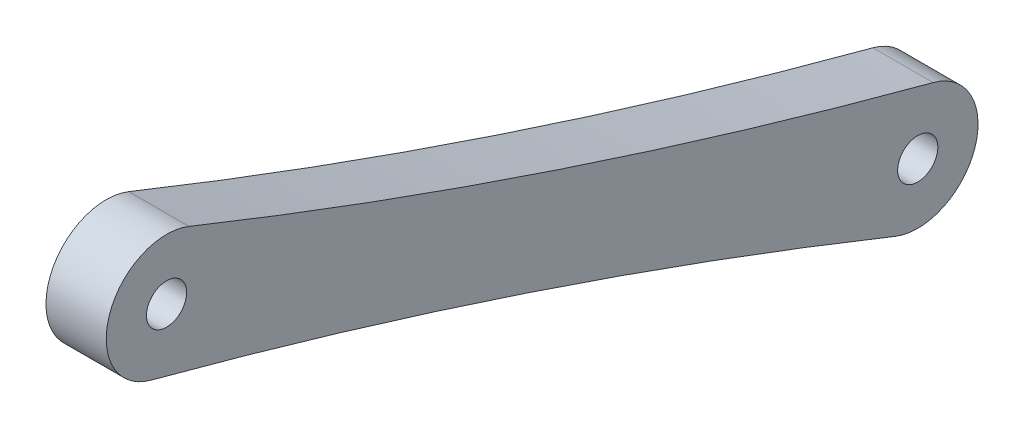
from build123d import *

# Parameters (mm, degrees)
SKETCH2_R               = 1
BOSS_EXTRUDE2_DEPTH     = 3
SCALE1_SCALE            = 2
CUT_EXTRUDE1_DEPTH      = 166.58723061
CUT_EXTRUDE1_DEPTH_BACK = 166.58723061


with BuildPart() as part:
    # Sketch2 → Boss-Extrude2 (new body)
    with BuildSketch(Plane.YZ):
        with BuildLine():
            ThreePointArc((19.533132157, 81.629722684), (24.352585485, 66.108442404), (37.508583242, 75.650821296))
            ThreePointArc((37.508583242, 75.650821296), (40.136593734, 92.158254486), (47.919515666, 106.951087747))
            ThreePointArc((47.919515666, 106.951087747), (43.100062338, 122.472368027), (29.944064581, 112.929989135))
            ThreePointArc((29.944064581, 112.929989135), (27.316054088, 96.422555945), (19.533132157, 81.629722684))
        make_face()
        with Locations(Location((39.943921454, 112.983491659, 0), (0, 0, 270))):
            Circle(SKETCH2_R, mode=Mode.SUBTRACT)
        with Locations(Location((27.508726369, 75.597318771, 0), (0, 0, 270))):
            Circle(SKETCH2_R, mode=Mode.SUBTRACT)
    extrude(amount=BOSS_EXTRUDE2_DEPTH)


with BuildPart() as part_1:
    # Scale1: scaled about (1.5, 33.726323911, 94.290405215)
    add(part.part.scale(SCALE1_SCALE).moved(Location((-1.5, -33.726323911, -94.290405215))))

    # Sketch3 → Cut-Extrude1 (cut, two sides: drawn at the far end of the back side and taken through both)
    # profile 1 of 2: a face of its own
    with BuildSketch(Plane.YZ.offset(4.5).offset(-CUT_EXTRUDE1_DEPTH_BACK)):
        with BuildLine():
            ThreePointArc((70.088301632, 113.579366365), (56.035739925, 86.869962872), (51.290699446, 57.064739901))
            ThreePointArc((51.290699446, 57.064739901), (11.822706174, 28.437603225), (-2.635653809, 75.001444065))
            ThreePointArc((-2.635653809, 75.001444065), (11.416907898, 101.710847558), (16.161948377, 131.516070529))
            ThreePointArc((16.161948377, 131.516070529), (55.629941649, 160.143207206), (70.088301632, 113.579366365))
        make_face()
        with BuildLine():
            ThreePointArc((26.16180525, 131.569573054), (20.905784266, 98.554706674), (5.339940403, 68.969040153))
            ThreePointArc((5.339940403, 68.969040153), (14.978847058, 37.926479592), (41.290842573, 57.011237377))
            ThreePointArc((41.290842573, 57.011237377), (46.546863557, 90.026103756), (62.11270742, 119.611770278))
            ThreePointArc((62.11270742, 119.611770278), (52.473800765, 150.654330838), (26.16180525, 131.569573054))
        make_face(mode=Mode.SUBTRACT)
    # profile 2 of 2: a face of its own
    with BuildSketch(Plane.YZ.offset(4.5).offset(-CUT_EXTRUDE1_DEPTH_BACK)):
        with BuildLine():
            ThreePointArc((62.11270742, 119.611770278), (52.473800765, 150.654330838), (26.16180525, 131.569573054))
            ThreePointArc((26.16180525, 131.569573054), (20.905784266, 98.554706674), (5.339940403, 68.969040153))
            ThreePointArc((5.339940403, 68.969040153), (14.978847058, 37.926479592), (41.290842573, 57.011237377))
            ThreePointArc((41.290842573, 57.011237377), (46.546863557, 90.026103756), (62.11270742, 119.611770278))
        make_face()
        with BuildLine():
            ThreePointArc((15.723577438, 59.140830534), (19.398551743, 51.210538273), (27.089730835, 55.362734759))
            ThreePointArc((27.089730835, 55.362734759), (38.273895697, 92.777815454), (51.72819988, 129.437814172))
            ThreePointArc((51.72819988, 129.437814172), (48.056310902, 137.369535475), (40.363517101, 133.220331331))
            ThreePointArc((40.363517101, 133.220331331), (29.171473339, 95.805416009), (15.723577438, 59.140830534))
        make_face(mode=Mode.SUBTRACT)
    extrude(amount=CUT_EXTRUDE1_DEPTH + CUT_EXTRUDE1_DEPTH_BACK, mode=Mode.SUBTRACT)


solid = part_1.part
